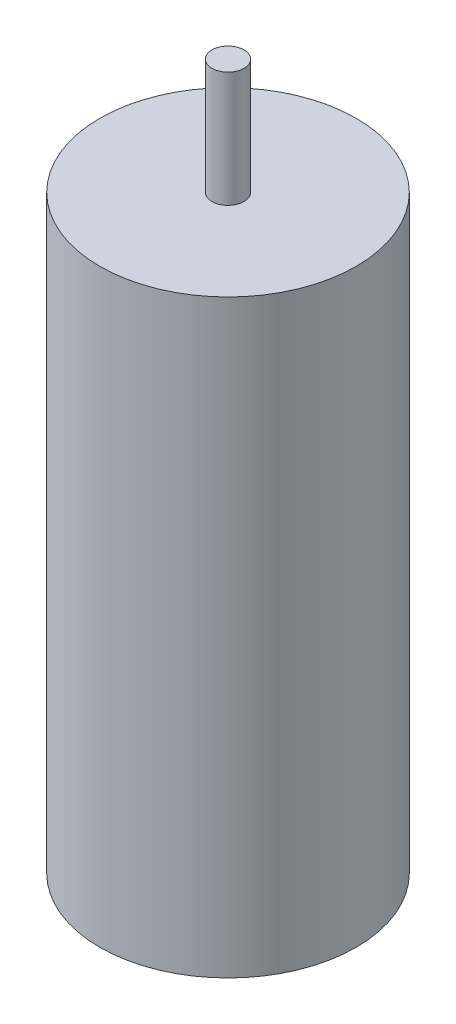
from build123d import *


with BuildPart() as part:
    # Sketch4 → Revolve1 (revolve)
    with BuildSketch(Plane.XY, mode=Mode.PRIVATE) as revolve1_sk:
        Polygon((0, -40.384716544), (20, -40.384716544), (20, 51.615283456), (2.5, 51.615283456), (2.5, 69.615283456), (0, 69.615283456), align=None)
    revolve(revolve1_sk.sketch.rotate(Axis((0, 88.106333556, 0), (0, -1, 0)), 90), axis=Axis((0, 88.106333556, 0), (0, -1, 0)))


solid = part.part
